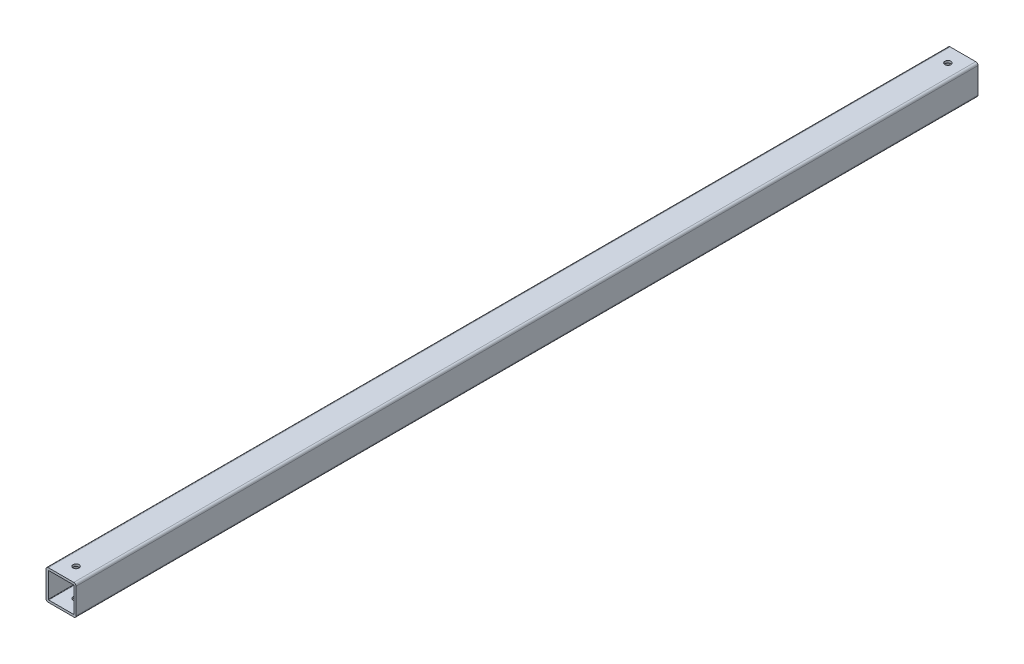
from build123d import *

# Parameters (mm, degrees)
SKETCH1_W                = 40
SKETCH1_H                = 40
SKETCH1_W_2              = 34
SKETCH1_H_2              = 34
EXTRUDE_THIN1_DEPTH      = 1200
FILLET1_R                = 0.5
FILLET2_R                = 3
F_8_0_8_DIAMETER_HOLE1_D = 8


with BuildPart() as part:
    # Sketch1 → Extrude-Thin1 (new body)
    with BuildSketch(Plane.XY):
        Rectangle(SKETCH1_W, SKETCH1_H)
        Rectangle(SKETCH1_W_2, SKETCH1_H_2, mode=Mode.SUBTRACT)
    extrude(amount=EXTRUDE_THIN1_DEPTH)

    # Fillet1
    fillet1_edges = [part.edges().sort_by_distance(p)[0] for p in [
        (17, -17, 600),
        (17, 17, 600),
        (-17, 17, 600),
        (-17, -17, 600),
    ]]
    fillet(fillet1_edges, radius=FILLET1_R)

    # Fillet2
    fillet2_edges = [part.edges().sort_by_distance(p)[0] for p in [
        (20, -20, 600),
        (-20, -20, 600),
        (-20, 20, 600),
        (20, 20, 600),
    ]]
    fillet(fillet2_edges, radius=FILLET2_R)

    # Ø8.0 (8) Diameter Hole1 (through all)
    with Locations(Plane(origin=(0, 20, 0), x_dir=(1, 0, 0), z_dir=(0, 1, 0))):
        with Locations((0, -20), (0, -1180)):
            Hole(F_8_0_8_DIAMETER_HOLE1_D / 2)


solid = part.part
